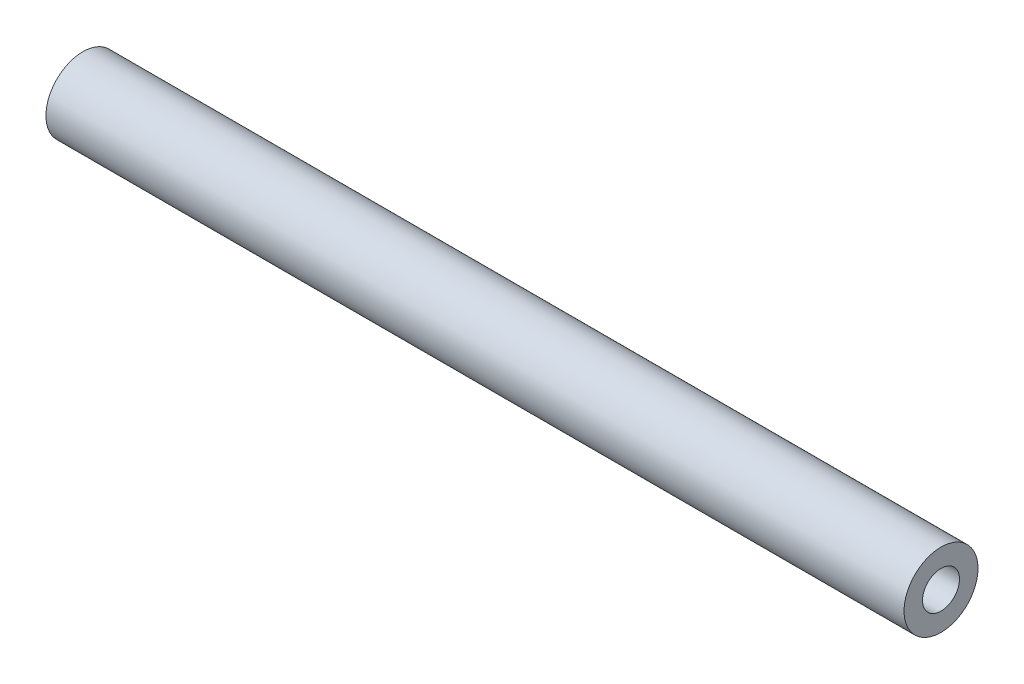
from build123d import *

# Parameters (mm, degrees)
SKETCH1_R           = 5
BOSS_EXTRUDE1_DEPTH = 116
SKETCH2_R           = 2.5
CUT_EXTRUDE1_DEPTH  = 26


with BuildPart() as part:
    # Sketch1 → Boss-Extrude1 (new body)
    with BuildSketch(Plane(origin=(0, 0, 0), x_dir=(0, 0, -1), z_dir=(1, 0, 0))):
        Circle(SKETCH1_R)
    extrude(amount=-BOSS_EXTRUDE1_DEPTH)

    # Sketch2 → Cut-Extrude1 (cut)
    with BuildSketch(Plane(origin=(0, 0, 0), x_dir=(0, 0, -1), z_dir=(1, 0, 0))):
        Circle(SKETCH2_R)
    extrude(amount=-CUT_EXTRUDE1_DEPTH, mode=Mode.SUBTRACT)


solid = part.part
